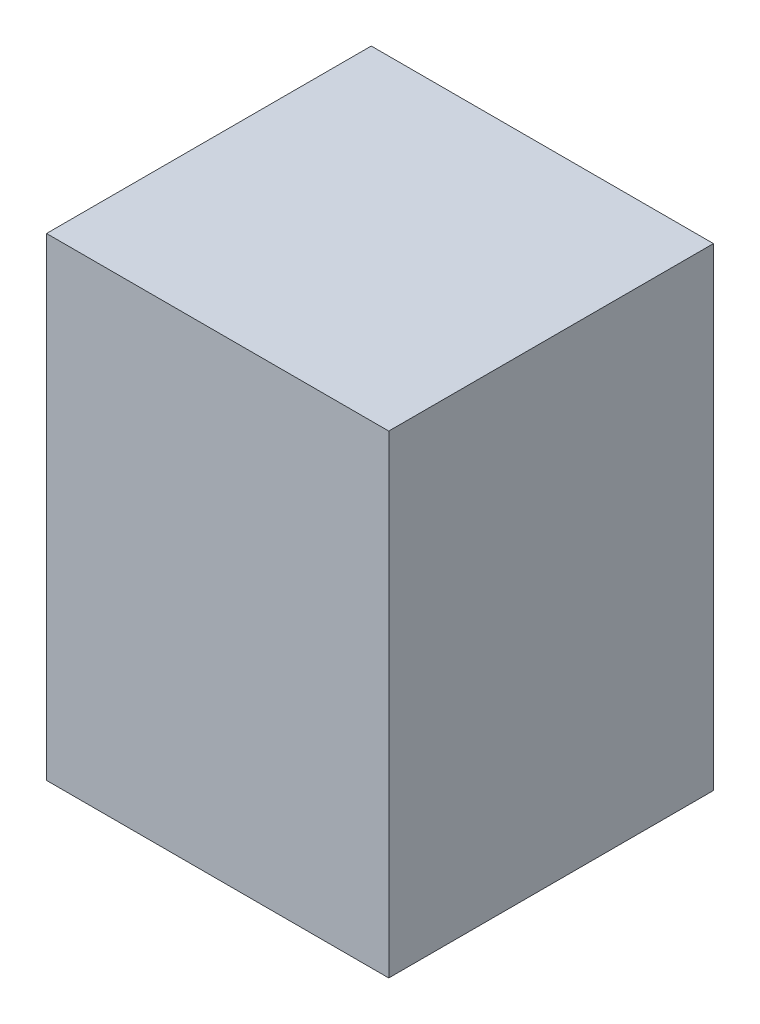
from build123d import *

# Parameters (mm, degrees)
SKETCH1_W           = 91.754625614
SKETCH1_H           = 87.06123902
BOSS_EXTRUDE1_DEPTH = 127


with BuildPart() as part:
    # Sketch1 → Boss-Extrude1 (new body)
    with BuildSketch(Plane(origin=(0, 0, 0), x_dir=(1, 0, 0), z_dir=(0, 1, 0))):
        with Locations((6.53471969, 5.025571237)):
            Rectangle(SKETCH1_W, SKETCH1_H)
    extrude(amount=BOSS_EXTRUDE1_DEPTH)


solid = part.part
